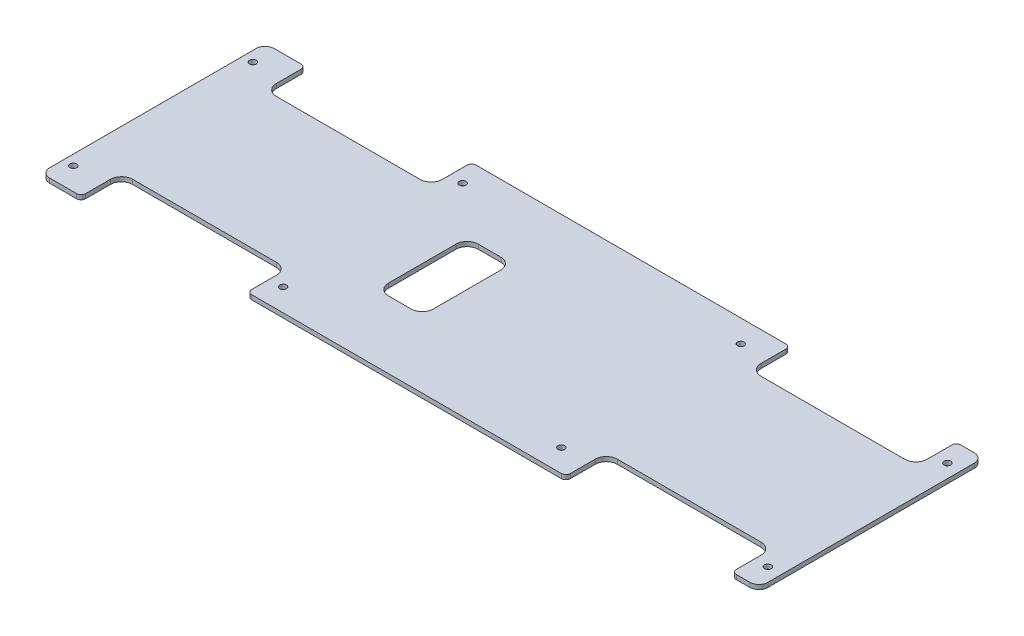
from build123d import *

# Parameters (mm, degrees)
SKETCH_1_R      = 1.5
EXTRUDE_1_DEPTH = 2


with BuildPart() as part:
    # 草图1 → 凸台-拉伸1 (new body)
    # profile 1 of 2: a face of its own
    with BuildSketch(Plane(origin=(0, 0, 0), x_dir=(1, 0, 0), z_dir=(0, 1, 0))):
        with BuildLine():
            Line((6, 50), (4, 50))
            ThreePointArc((4, 50), (1.171572875, 48.828427125), (0, 46))
            Line((0, 46), (0, 0))
            Line((0, 0), (120, 0))
            Line((120, 0), (120, 15))
            ThreePointArc((120, 15), (121.464466094, 18.535533906), (125, 20))
            Line((125, 20), (135, 20))
            ThreePointArc((135, 20), (138.535533906, 18.535533906), (140, 15))
            Line((140, 15), (140, 0))
            Line((140, 0), (320, 0))
            Line((320, 0), (320, 46))
            ThreePointArc((320, 46), (318.828427125, 48.828427125), (316, 50))
            Line((316, 50), (310, 50))
            ThreePointArc((310, 50), (308.585786438, 49.414213562), (308, 48))
            Line((308, 48), (308, 37))
            ThreePointArc((308, 37), (306.535533906, 33.464466094), (303, 32))
            Line((303, 32), (239, 32))
            ThreePointArc((239, 32), (235.464466094, 33.464466094), (234, 37))
            Line((234, 37), (234, 48))
            ThreePointArc((234, 48), (233.414213562, 49.414213562), (232, 50))
            Line((232, 50), (94, 50))
            ThreePointArc((94, 50), (92.585786438, 49.414213562), (92, 48))
            Line((92, 48), (92, 37))
            ThreePointArc((92, 37), (90.535533906, 33.464466094), (87, 32))
            Line((87, 32), (23, 32))
            ThreePointArc((23, 32), (19.464466094, 33.464466094), (18, 37))
            Line((18, 37), (18, 48))
            ThreePointArc((18, 48), (17.414213562, 49.414213562), (16, 50))
            Line((16, 50), (6, 50))
        make_face()
        with Locations(Location((4.503217652, 40, 0), (0, 0, 270))):
            Circle(SKETCH_1_R, mode=Mode.SUBTRACT)
        with Locations(Location((98, 40, 0), (0, 0, 270))):
            Circle(SKETCH_1_R, mode=Mode.SUBTRACT)
        with Locations(Location((222, 40, 0), (0, 0, 270))):
            Circle(SKETCH_1_R, mode=Mode.SUBTRACT)
        with Locations(Location((314, 40, 0), (0, 0, 270))):
            Circle(SKETCH_1_R, mode=Mode.SUBTRACT)
    # profile 2 of 2: a face of its own
    with BuildSketch(Plane(origin=(0, 0, 0), x_dir=(1, 0, 0), z_dir=(0, 1, 0))):
        with BuildLine():
            Line((120, 0), (0, 0))
            Line((0, 0), (0, -46))
            ThreePointArc((0, -46), (1.171572875, -48.828427125), (4, -50))
            Line((4, -50), (6, -50))
            Line((6, -50), (16, -50))
            ThreePointArc((16, -50), (17.414213562, -49.414213562), (18, -48))
            Line((18, -48), (18, -37))
            ThreePointArc((18, -37), (19.464466094, -33.464466094), (23, -32))
            Line((23, -32), (87, -32))
            ThreePointArc((87, -32), (90.535533906, -33.464466094), (92, -37))
            Line((92, -37), (92, -48))
            ThreePointArc((92, -48), (92.585786438, -49.414213562), (94, -50))
            Line((94, -50), (232, -50))
            ThreePointArc((232, -50), (233.414213562, -49.414213562), (234, -48))
            Line((234, -48), (234, -37))
            ThreePointArc((234, -37), (235.464466094, -33.464466094), (239, -32))
            Line((239, -32), (303, -32))
            ThreePointArc((303, -32), (306.535533906, -33.464466094), (308, -37))
            Line((308, -37), (308, -48))
            ThreePointArc((308, -48), (308.585786438, -49.414213562), (310, -50))
            Line((310, -50), (316, -50))
            ThreePointArc((316, -50), (318.828427125, -48.828427125), (320, -46))
            Line((320, -46), (320, 0))
            Line((320, 0), (140, 0))
            Line((140, 0), (140, -15))
            ThreePointArc((140, -15), (138.535533906, -18.535533906), (135, -20))
            Line((135, -20), (125, -20))
            ThreePointArc((125, -20), (121.464466094, -18.535533906), (120, -15))
            Line((120, -15), (120, 0))
        make_face()
        with Locations(Location((4.503217652, -40, 0), (0, 0, 270))):
            Circle(SKETCH_1_R, mode=Mode.SUBTRACT)
        with Locations(Location((98, -40, 0), (0, 0, 270))):
            Circle(SKETCH_1_R, mode=Mode.SUBTRACT)
        with Locations(Location((222, -40, 0), (0, 0, 270))):
            Circle(SKETCH_1_R, mode=Mode.SUBTRACT)
        with Locations(Location((314, -40, 0), (0, 0, 270))):
            Circle(SKETCH_1_R, mode=Mode.SUBTRACT)
    extrude(amount=EXTRUDE_1_DEPTH)


solid = part.part
